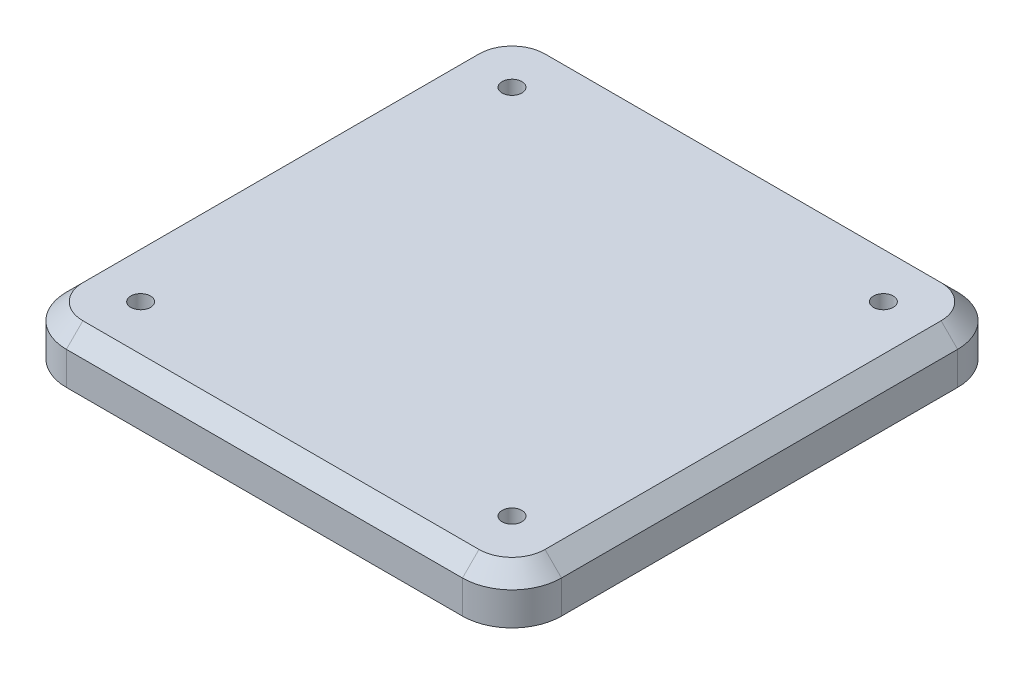
from build123d import *

# Parameters (mm, degrees)
SKETCH_1_W                 = 300
SKETCH_1_H                 = 300
EXTRUDE_1_DEPTH            = 30
FILLET_1_R                 = 30
CHAMFER_1_SIZE             = 10
F_20_0MM_1_D               = 12
F_20_0MM_1_DEPTH           = 10
F_20_0MM_1_TIP             = 3.605163714
F_20_0MM_1_ON_FACE_2_D     = 12
F_20_0MM_1_ON_FACE_2_DEPTH = 10
F_20_0MM_1_ON_FACE_2_TIP   = 3.605163714


with BuildPart() as part:
    # 草圖1 → 填料-伸長1 (new body)
    with BuildSketch(Plane(origin=(0, 0, 0), x_dir=(1, 0, 0), z_dir=(0, 1, 0))):
        with Locations((150, 150)):
            Rectangle(SKETCH_1_W, SKETCH_1_H)
    extrude(amount=EXTRUDE_1_DEPTH)

    # 圓角1
    fillet_1_edges = [part.edges().sort_by_distance(p)[0] for p in [
        (0, 15, -300),
        (300, 15, -300),
        (300, 15, 0),
        (0, 15, 0),
    ]]
    fillet(fillet_1_edges, radius=FILLET_1_R)

    # 導角1
    chamfer_1_edges = [part.edges().sort_by_distance(p)[0] for p in [
        (0, 30, -150),
        (150, 30, -300),
        (150, 30, 0),
        (300, 30, -150),
        (8.786796564, 30, -8.786796564),
        (291.213203436, 30, -8.786796564),
        (291.213203436, 30, -291.213203436),
        (8.786796564, 30, -291.213203436),
    ]]
    chamfer(chamfer_1_edges, length=CHAMFER_1_SIZE)

    # Ø20.0mm 定位孔1
    with Locations(Plane(origin=(37.5, 30, -37.5), x_dir=(0, 0, 1), z_dir=(0, 1, 0))):
        with Locations((0, 0), (-225, 0), (-225, 225), (0, 225)):
            Hole(F_20_0MM_1_D / 2, depth=F_20_0MM_1_DEPTH)
            with Locations((0, 0, -(F_20_0MM_1_DEPTH + F_20_0MM_1_TIP / 2))):  # 118° drill point
                Cone(0, F_20_0MM_1_D / 2, F_20_0MM_1_TIP, mode=Mode.SUBTRACT)

    # Ø20.0mm 定位孔1 on face 2
    with Locations(Plane(origin=(25, 0, -25), x_dir=(0, 0, -1), z_dir=(0, -1, 0))):
        with Locations((0, 0), (0, 250), (250, 250), (250, 0)):
            Hole(F_20_0MM_1_ON_FACE_2_D / 2, depth=F_20_0MM_1_ON_FACE_2_DEPTH)
            with Locations((0, 0, -(F_20_0MM_1_ON_FACE_2_DEPTH + F_20_0MM_1_ON_FACE_2_TIP / 2))):  # 118° drill point
                Cone(0, F_20_0MM_1_ON_FACE_2_D / 2, F_20_0MM_1_ON_FACE_2_TIP, mode=Mode.SUBTRACT)


solid = part.part
